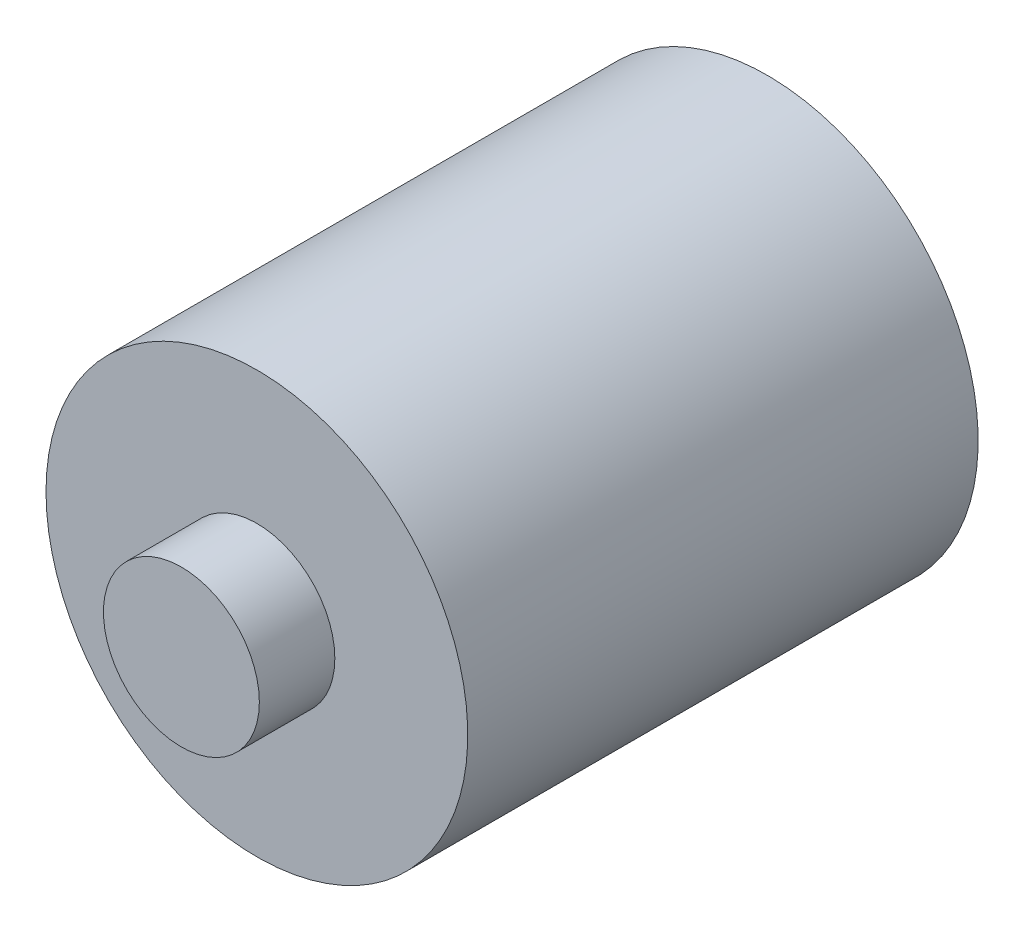
from build123d import *

# Parameters (mm, degrees)
SKETCH_1_R          = 12.85
EXTRUDE_1_DEPTH     = 31.1
SKETCH_2_R          = 4.75
EXTRUDE_2_DEPTH     = 4.6
SKETCH_3_R          = 6
CUT_EXTRUDE_3_DEPTH = 16


with BuildPart() as part:
    # 草圖1 → 伸長1 (new body)
    with BuildSketch(Plane.XY):
        with Locations(Location((0, 0, 0), (0, 0, 180))):
            Circle(SKETCH_1_R)
    extrude(amount=EXTRUDE_1_DEPTH)

    # 草圖2 → 伸長2 (add)
    with BuildSketch(Plane.XY.offset(31.1)):
        Circle(SKETCH_2_R)
    extrude(amount=EXTRUDE_2_DEPTH)

    # 草圖3 → 伸長3 (cut)
    with BuildSketch(Plane(origin=(0, 0, 0), x_dir=(-1, 0, 0), z_dir=(0, 0, -1))):
        Circle(SKETCH_3_R)
    extrude(amount=-CUT_EXTRUDE_3_DEPTH, mode=Mode.SUBTRACT)


solid = part.part
